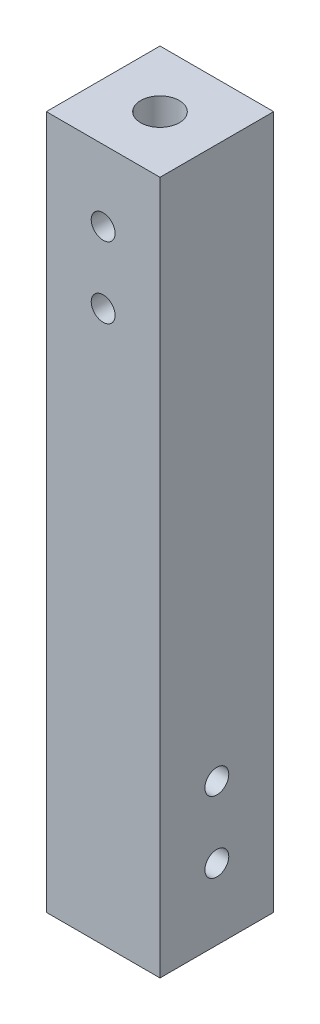
from build123d import *

# Parameters (mm, degrees)
SKETCH1_W             = 20
SKETCH1_H             = 20
BOSS_EXTRUDE1_DEPTH   = 122
M5_TAPPED_HOLE1_D     = 4.2
M5_TAPPED_HOLE1_DEPTH = 12.4
M5_TAPPED_HOLE1_TIP   = 1.2618073
M5_TAPPED_HOLE2_D     = 4.2
M5_TAPPED_HOLE2_DEPTH = 12.4
M5_TAPPED_HOLE2_TIP   = 1.2618073


with BuildPart() as part:
    # Sketch1 → Boss-Extrude1 (new body)
    with BuildSketch(Plane(origin=(0, 0, 0), x_dir=(1, 0, 0), z_dir=(0, 1, 0))):
        with Locations((10, 10)):
            Rectangle(SKETCH1_W, SKETCH1_H)
    extrude(amount=BOSS_EXTRUDE1_DEPTH)

    # Sketch5 → M8 Tapped Hole1 (revolve, cut)
    with BuildSketch(Plane(origin=(10, 122, -10), x_dir=(0, 0, 1), z_dir=(1, 0, 0))):
        Polygon((0, 0), (0, 21.792926105), (3.4, 19.75), (3.4, 0), align=None)
    m8_tapped_hole1 = revolve(axis=Axis((10, 128.35, -10), (0, -1, 0)), mode=Mode.SUBTRACT)

    # Mirror1: M8 Tapped Hole1 across plane
    add(m8_tapped_hole1.mirror(Plane.ZX.offset(61)), mode=Mode.SUBTRACT)

    # M5 Tapped Hole1
    with Locations(Plane.XY):
        with Locations((10, 97), (10, 109.5)):
            Hole(M5_TAPPED_HOLE1_D / 2, depth=M5_TAPPED_HOLE1_DEPTH)
            with Locations((0, 0, -(M5_TAPPED_HOLE1_DEPTH + M5_TAPPED_HOLE1_TIP / 2))):  # 118° drill point
                Cone(0, M5_TAPPED_HOLE1_D / 2, M5_TAPPED_HOLE1_TIP, mode=Mode.SUBTRACT)

    # M5 Tapped Hole2
    with Locations(Plane(origin=(20, 0, 0), x_dir=(0, 0, -1), z_dir=(1, 0, 0))):
        with Locations((10, 12.5), (10, 25)):
            Hole(M5_TAPPED_HOLE2_D / 2, depth=M5_TAPPED_HOLE2_DEPTH)
            with Locations((0, 0, -(M5_TAPPED_HOLE2_DEPTH + M5_TAPPED_HOLE2_TIP / 2))):  # 118° drill point
                Cone(0, M5_TAPPED_HOLE2_D / 2, M5_TAPPED_HOLE2_TIP, mode=Mode.SUBTRACT)


solid = part.part
